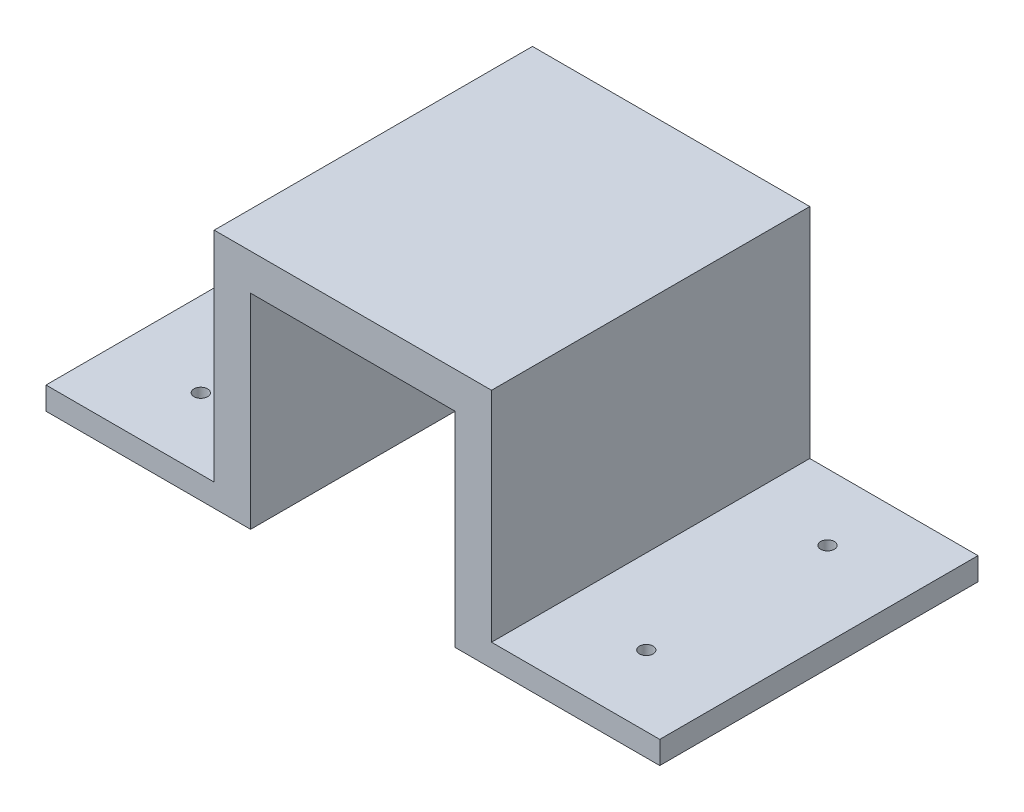
from build123d import *

# Parameters (mm, degrees)
BOSS_EXTRUDE1_DEPTH = 70
SKETCH6_R           = 1.5
CUT_EXTRUDE1_DEPTH  = 70


with BuildPart() as part:
    # Sketch1 → Boss-Extrude1 (new body)
    with BuildSketch(Plane.XY):
        Polygon((-68.951612903, 0), (-23.951612903, 0), (-23.951612903, 45), (21.048387097, 45), (21.048387097, 0), (66.048387097, 0), (66.048387097, 5), (29.048387097, 5), (29.048387097, 53), (-31.951612903, 53), (-31.951612903, 5), (-68.951612903, 5), align=None)
    extrude(amount=BOSS_EXTRUDE1_DEPTH)

    # Sketch6 → Cut-Extrude1 (cut)
    with BuildSketch(Plane(origin=(0, 5, 0), x_dir=(1, 0, 0), z_dir=(0, 1, 0))):
        with Locations(Location((-50.451612903, -14.603137979, 0), (0, 0, 180))):
            Circle(SKETCH6_R)
        with Locations(Location((-50.451612903, -54.455468389, 0), (0, 0, 180))):
            Circle(SKETCH6_R)
        with Locations(Location((47.548387097, -14.603137979, 0), (0, 0, 180))):
            Circle(SKETCH6_R)
        with Locations(Location((47.548387097, -54.455468389, 0), (0, 0, 180))):
            Circle(SKETCH6_R)
    extrude(amount=-CUT_EXTRUDE1_DEPTH, mode=Mode.SUBTRACT)


solid = part.part
